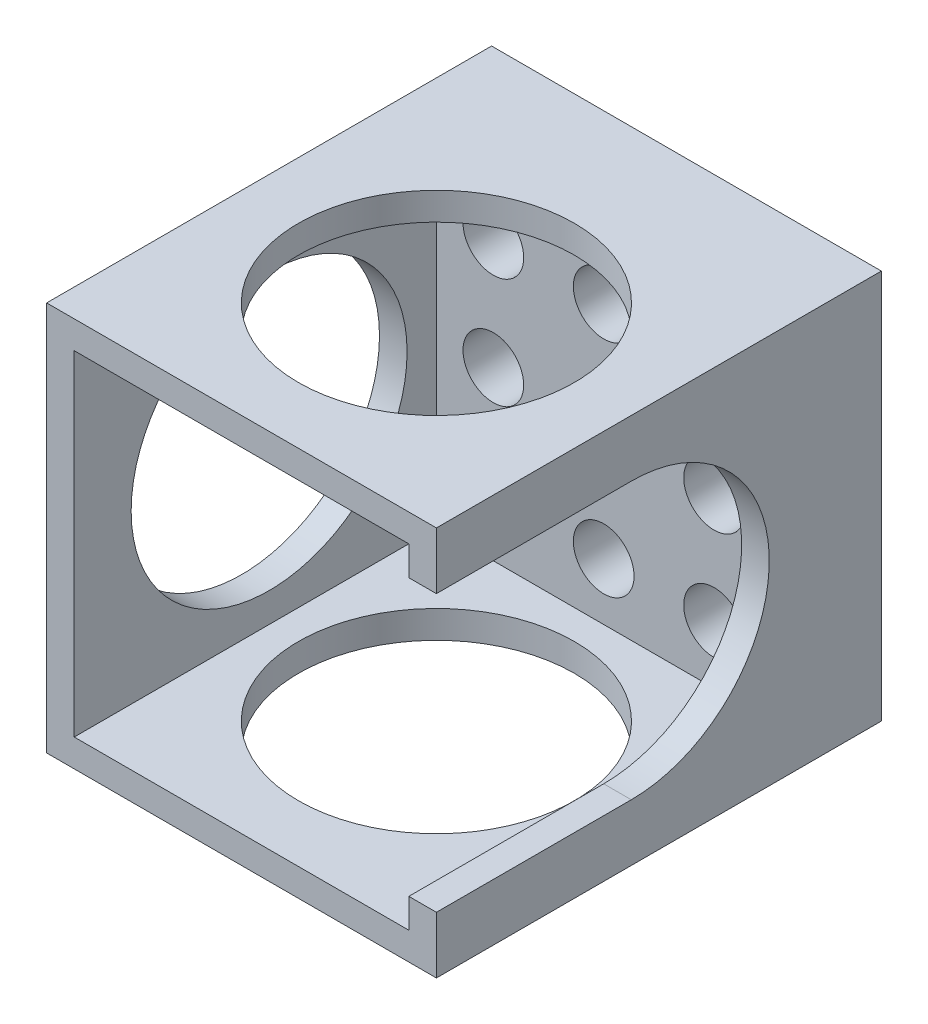
from build123d import *

# Parameters (mm, degrees)
SKETCH1_W           = 44.85
SKETCH1_H           = 44.85
SKETCH1_W_2         = 38.5
SKETCH1_H_2         = 38.5
BOSS_EXTRUDE1_DEPTH = 19.25
SKETCH2_W           = 44.85
SKETCH2_H           = 44.85
BOSS_EXTRUDE2_DEPTH = 3.175
SKETCH3_W           = 44.85
SKETCH3_H           = 44.85
BOSS_EXTRUDE3_DEPTH = 3.175
SKETCH5_R           = 15.875
CUT_EXTRUDE1_DEPTH  = 68.275
SKETCH8_W           = 44.85
SKETCH8_H           = 44.85
SKETCH8_R           = 2.2225
BOSS_EXTRUDE4_DEPTH = 6.35
SKETCH9_R           = 3.4925
CUT_EXTRUDE4_DEPTH  = 6.35
CUT_EXTRUDE5_REACH  = 62.226
SKETCH10_W          = 38.5
SKETCH10_H          = 38.5
CUT_EXTRUDE3_DEPTH  = 43.822445925
SKETCH11_R          = 15.875
CUT_EXTRUDE6_DEPTH  = 43.822445925


with BuildPart() as part:
    # Sketch1 → Boss-Extrude1 (new, symmetric)
    with BuildSketch(Plane(origin=(0, 0, 0), x_dir=(1, 0, 0), z_dir=(0, 1, 0))):
        Rectangle(SKETCH1_W, SKETCH1_H)
        Rectangle(SKETCH1_W_2, SKETCH1_H_2, mode=Mode.SUBTRACT)
    extrude(amount=BOSS_EXTRUDE1_DEPTH, both=True)

    # Sketch2 → Boss-Extrude2 (add)
    with BuildSketch(Plane(origin=(0, 19.25, 0), x_dir=(1, 0, 0), z_dir=(0, 1, 0))):
        Rectangle(SKETCH2_W, SKETCH2_H)
    extrude(amount=BOSS_EXTRUDE2_DEPTH)

    # Sketch3 → Boss-Extrude3 (add)
    with BuildSketch(Plane.XZ.offset(19.25)):
        Rectangle(SKETCH3_W, SKETCH3_H)
    extrude(amount=BOSS_EXTRUDE3_DEPTH)

    # Sketch5 → Cut-Extrude1 (cut, through all)
    with BuildSketch(Plane(origin=(0, -22.425, -22.425), x_dir=(1, 0, 0), z_dir=(0, 1, 0))):
        with Locations(Location((0, -22.425, 0), (0, 0, 90))):
            Circle(SKETCH5_R)
    extrude(amount=CUT_EXTRUDE1_DEPTH, mode=Mode.SUBTRACT)

    # Sketch8 → Boss-Extrude4 (add)
    with BuildSketch(Plane(origin=(0, 0, -22.425), x_dir=(-1, 0, 0), z_dir=(0, 0, -1))):
        Rectangle(SKETCH8_W, SKETCH8_H)
        with Locations((-12.7, 12.7)):
            Circle(SKETCH8_R, mode=Mode.SUBTRACT)
        with Locations((0, 12.7)):
            Circle(SKETCH8_R, mode=Mode.SUBTRACT)
        with Locations((12.7, 12.7)):
            Circle(SKETCH8_R, mode=Mode.SUBTRACT)
        Circle(SKETCH8_R, mode=Mode.SUBTRACT)
        with Locations((12.7, 0)):
            Circle(SKETCH8_R, mode=Mode.SUBTRACT)
        with Locations((0, -12.7)):
            Circle(SKETCH8_R, mode=Mode.SUBTRACT)
        with Locations((12.7, -12.7)):
            Circle(SKETCH8_R, mode=Mode.SUBTRACT)
        with Locations((-12.7, 0)):
            Circle(SKETCH8_R, mode=Mode.SUBTRACT)
        with Locations((-12.7, -12.7)):
            Circle(SKETCH8_R, mode=Mode.SUBTRACT)
    extrude(amount=BOSS_EXTRUDE4_DEPTH)

    # Sketch9 → Cut-Extrude4 (cut)
    with BuildSketch(Plane.XY.offset(-19.25)):
        with Locations((12.7, 12.7)):
            Circle(SKETCH9_R)
        with Locations((0, 12.7)):
            Circle(SKETCH9_R)
        with Locations((-12.7, 12.7)):
            Circle(SKETCH9_R)
        Circle(SKETCH9_R)
        with Locations((-12.7, 0)):
            Circle(SKETCH9_R)
        with Locations((0, -12.7)):
            Circle(SKETCH9_R)
        with Locations((-12.7, -12.7)):
            Circle(SKETCH9_R)
        with Locations((12.7, 0)):
            Circle(SKETCH9_R)
        with Locations((12.7, -12.7)):
            Circle(SKETCH9_R)
    extrude(amount=-CUT_EXTRUDE4_DEPTH, mode=Mode.SUBTRACT)

    # Sketch10 → Cut-Extrude5 (cut, up to next)
    with BuildSketch(Plane.XY.offset(22.425), mode=Mode.PRIVATE) as cut_extrude5_sk1:
        Rectangle(SKETCH10_W, SKETCH10_H)
    cut_extrude5_tool1 = extrude(cut_extrude5_sk1.sketch, amount=-CUT_EXTRUDE5_REACH, mode=Mode.PRIVATE) & part.part
    add(cut_extrude5_tool1.solids().sort_by_distance((0, 0, 22.425))[0], mode=Mode.SUBTRACT)

    # Sketch7 → Cut-Extrude3 (cut, through all)
    with BuildSketch(Plane.ZY):
        with BuildLine():
            Line((0, 15.875), (25, 15.875))
            Line((25, 15.875), (25, -15.875))
            Line((25, -15.875), (0, -15.875))
            ThreePointArc((0, -15.875), (-15.875, 0), (0, 15.875))
        make_face()
    extrude(amount=-CUT_EXTRUDE3_DEPTH, mode=Mode.SUBTRACT)

    # Sketch11 → Cut-Extrude6 (cut, through all)
    with BuildSketch(Plane(origin=(0, 0, 0), x_dir=(0, 0, -1), z_dir=(1, 0, 0))):
        Circle(SKETCH11_R)
    extrude(amount=-CUT_EXTRUDE6_DEPTH, mode=Mode.SUBTRACT)


solid = part.part
